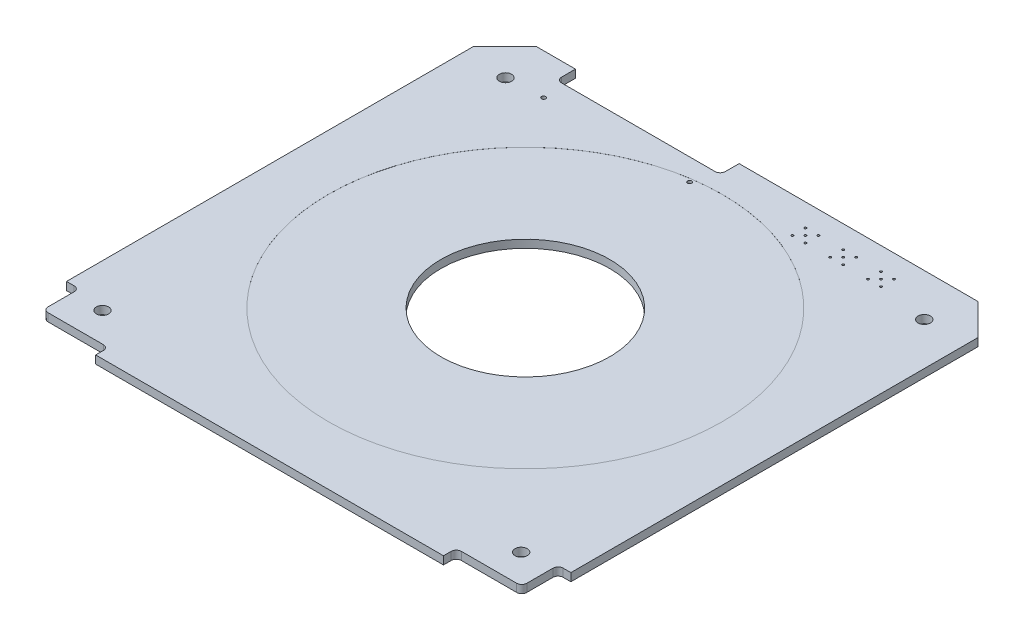
from build123d import *

# Parameters (mm, degrees)
SKETCH1_R                = 0.4
SKETCH1_R_2              = 0.2125
BOSS_EXTRUDE1_DEPTH      = 1.56
M2_CLEARANCE_HOLE2_D     = 2.4
M2_CLEARANCE_HOLE2_DEPTH = 38.1
M2_CLEARANCE_HOLE2_TIP   = 0.721032743
SKETCH2_R                = 38.5
CUT_EXTRUDE1_DEPTH       = 0.01
SKETCH10_R               = 16.5
CUT_EXTRUDE2_DEPTH       = 10


with BuildPart() as part:
    # Sketch1 → Boss-Extrude1 (new body)
    with BuildSketch(Plane(origin=(0, 0, 0), x_dir=(1, 0, 0), z_dir=(0, 1, 0))):
        with BuildLine():
            Line((-49.356685196, 41.604788024), (-43.256685196, 47.704788024))
            Line((-43.256685196, 47.704788024), (-35.556685196, 47.704788024))
            Line((-35.556685196, 47.704788024), (-35.556685196, 45.004788024))
            ThreePointArc((-35.556685196, 45.004788024), (-35.263791977, 44.297681243), (-34.556685196, 44.004788024))
            Line((-34.556685196, 44.004788024), (-4.556685196, 44.004788024))
            ThreePointArc((-4.556685196, 44.004788024), (-3.849578415, 44.297681243), (-3.556685196, 45.004788024))
            Line((-3.556685196, 45.004788024), (-3.556685196, 47.704788024))
            Line((-3.556685196, 47.704788024), (43.143314804, 47.704788024))
            Line((43.143314804, 47.704788024), (49.243314804, 41.604788024))
            Line((49.243314804, 41.604788024), (49.243314804, -37.995211976))
            Line((49.243314804, -37.995211976), (47.743314804, -37.995211976))
            ThreePointArc((47.743314804, -37.995211976), (47.036208023, -38.288105194), (46.743314804, -38.995211976))
            Line((46.743314804, -38.995211976), (46.743314804, -44.095211976))
            ThreePointArc((46.743314804, -44.095211976), (46.450421585, -44.802318757), (45.743314804, -45.095211976))
            Line((45.743314804, -45.095211976), (34.943314804, -45.095211976))
            ThreePointArc((34.943314804, -45.095211976), (34.236208023, -45.388105194), (33.943314804, -46.095211976))
            Line((33.943314804, -46.095211976), (33.943314804, -47.595211976))
            Line((33.943314804, -47.595211976), (-34.056685196, -47.595211976))
            Line((-34.056685196, -47.595211976), (-34.056685196, -46.095211976))
            ThreePointArc((-34.056685196, -46.095211976), (-34.349578415, -45.388105194), (-35.056685196, -45.095211976))
            Line((-35.056685196, -45.095211976), (-45.856685196, -45.095211976))
            ThreePointArc((-45.856685196, -45.095211976), (-46.563791977, -44.802318757), (-46.856685196, -44.095211976))
            Line((-46.856685196, -44.095211976), (-46.856685196, -38.995211976))
            ThreePointArc((-46.856685196, -38.995211976), (-47.149578415, -38.288105194), (-47.856685196, -37.995211976))
            Line((-47.856685196, -37.995211976), (-49.356685196, -37.995211976))
            Line((-49.356685196, -37.995211976), (-49.356685196, 41.604788024))
        make_face()
        with Locations(Location((-33.826685196, 39.744788024, 0), (0, 0, 270))):
            Circle(SKETCH1_R, mode=Mode.SUBTRACT)
        with Locations(Location((-5.276685196, 39.744788024, 0), (0, 0, 270))):
            Circle(SKETCH1_R, mode=Mode.SUBTRACT)
        with Locations(Location((29.883314804, 42.004788024, 0), (0, 0, 270))):
            Circle(SKETCH1_R_2, mode=Mode.SUBTRACT)
        with Locations(Location((28.613314804, 43.274788024, 0), (0, 0, 270))):
            Circle(SKETCH1_R_2, mode=Mode.SUBTRACT)
        with Locations(Location((31.153314804, 43.274788024, 0), (0, 0, 270))):
            Circle(SKETCH1_R_2, mode=Mode.SUBTRACT)
        with Locations(Location((31.153314804, 40.734788024, 0), (0, 0, 270))):
            Circle(SKETCH1_R_2, mode=Mode.SUBTRACT)
        with Locations(Location((28.613314804, 40.734788024, 0), (0, 0, 270))):
            Circle(SKETCH1_R_2, mode=Mode.SUBTRACT)
        with Locations(Location((22.483314804, 42.004788024, 0), (0, 0, 270))):
            Circle(SKETCH1_R_2, mode=Mode.SUBTRACT)
        with Locations(Location((21.213314804, 43.274788024, 0), (0, 0, 270))):
            Circle(SKETCH1_R_2, mode=Mode.SUBTRACT)
        with Locations(Location((23.753314804, 43.274788024, 0), (0, 0, 270))):
            Circle(SKETCH1_R_2, mode=Mode.SUBTRACT)
        with Locations(Location((23.753314804, 40.734788024, 0), (0, 0, 270))):
            Circle(SKETCH1_R_2, mode=Mode.SUBTRACT)
        with Locations(Location((21.213314804, 40.734788024, 0), (0, 0, 270))):
            Circle(SKETCH1_R_2, mode=Mode.SUBTRACT)
        with Locations(Location((15.083314804, 42.004788024, 0), (0, 0, 270))):
            Circle(SKETCH1_R_2, mode=Mode.SUBTRACT)
        with Locations(Location((13.813314804, 43.274788024, 0), (0, 0, 270))):
            Circle(SKETCH1_R_2, mode=Mode.SUBTRACT)
        with Locations(Location((16.353314804, 43.274788024, 0), (0, 0, 270))):
            Circle(SKETCH1_R_2, mode=Mode.SUBTRACT)
        with Locations(Location((16.353314804, 40.734788024, 0), (0, 0, 270))):
            Circle(SKETCH1_R_2, mode=Mode.SUBTRACT)
        with Locations(Location((13.813314804, 40.734788024, 0), (0, 0, 270))):
            Circle(SKETCH1_R_2, mode=Mode.SUBTRACT)
    extrude(amount=BOSS_EXTRUDE1_DEPTH)

    # M2 Clearance Hole2
    with Locations(Plane(origin=(0, 1.56, 0), x_dir=(1, 0, 0), z_dir=(0, 1, 0))):
        with Locations((-40.929491149, 39.39737116), (40.929491149, 39.39737116), (40.929491149, -39.39737116), (-40.929491149, -39.39737116)):
            Hole(M2_CLEARANCE_HOLE2_D / 2, depth=M2_CLEARANCE_HOLE2_DEPTH)
            with Locations((0, 0, -(M2_CLEARANCE_HOLE2_DEPTH + M2_CLEARANCE_HOLE2_TIP / 2))):  # 118° drill point
                Cone(0, M2_CLEARANCE_HOLE2_D / 2, M2_CLEARANCE_HOLE2_TIP, mode=Mode.SUBTRACT)

    # Sketch2 → Cut-Extrude1 (cut)
    with BuildSketch(Plane(origin=(0, 1.56, 0), x_dir=(1, 0, 0), z_dir=(0, 1, 0))):
        with Locations(Location((0, 2.34737116, 0), (0, 0, 270))):
            Circle(SKETCH2_R)
    extrude(amount=-CUT_EXTRUDE1_DEPTH, mode=Mode.SUBTRACT)

    # Sketch10 → Cut-Extrude2 (cut)
    with BuildSketch(Plane(origin=(0, 1.55, 0), x_dir=(1, 0, 0), z_dir=(0, 1, 0))):
        with Locations(Location((0, 2.34737116, 0), (0, 0, 270))):
            Circle(SKETCH10_R)
    extrude(amount=-CUT_EXTRUDE2_DEPTH, mode=Mode.SUBTRACT)


solid = part.part
